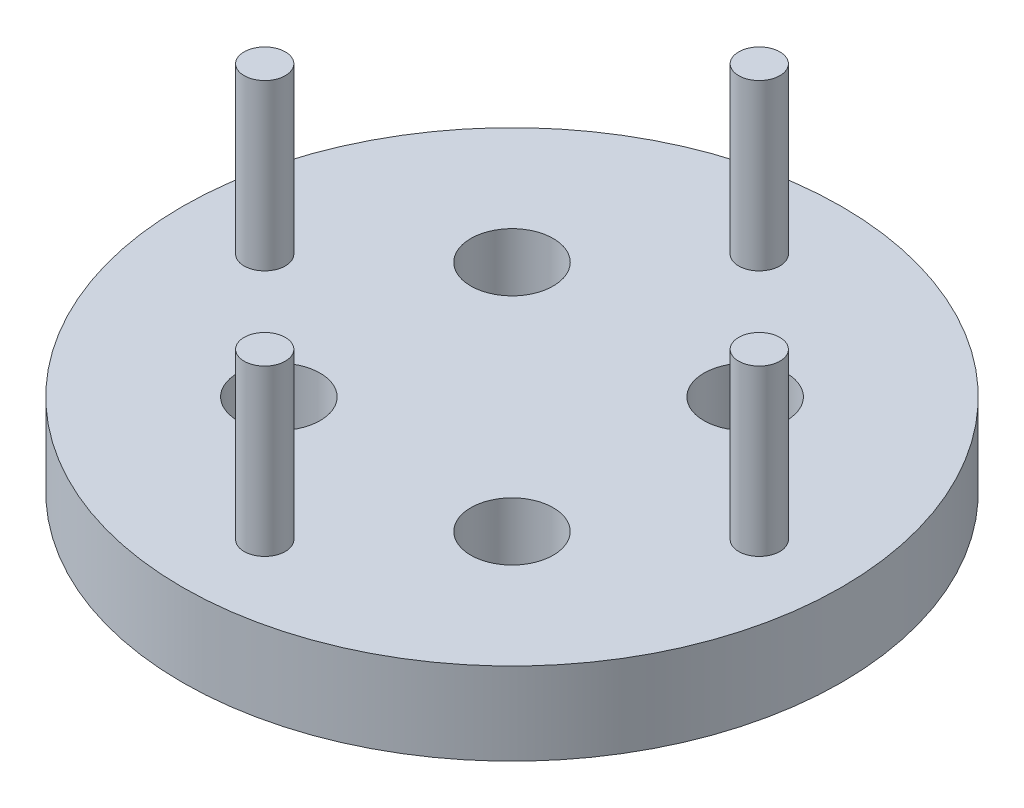
from build123d import *

# Parameters (mm, degrees)
SKETCH1_R           = 25.4
BOSS_EXTRUDE1_DEPTH = 6.35
SKETCH2_R           = 1.5875
BOSS_EXTRUDE2_DEPTH = 12.7
CIRPATTERN1_COUNT   = 4
SKETCH3_R           = 3.175
CUT_EXTRUDE1_DEPTH  = 41.659838908
CIRPATTERN2_COUNT   = 4


with BuildPart() as part:
    # Sketch1 → Boss-Extrude1 (new body)
    with BuildSketch(Plane(origin=(0, 0, 0), x_dir=(1, 0, 0), z_dir=(0, 1, 0))):
        with Locations(Location((0, 0, 0), (0, 0, 270))):
            Circle(SKETCH1_R)
    extrude(amount=BOSS_EXTRUDE1_DEPTH)

    # Sketch2 → Boss-Extrude2 (add)
    with BuildSketch(Plane(origin=(0, 6.35, 0), x_dir=(1, 0, 0), z_dir=(0, 1, 0))):
        with Locations(Location((-19.05, 0, 0), (0, 0, 270))):
            Circle(SKETCH2_R)
    boss_extrude2 = extrude(amount=BOSS_EXTRUDE2_DEPTH)

    # CirPattern1: Boss-Extrude2 ×4 about axis
    cirpattern1_axis = Axis((0, 0, 0), (0, 1, 0))
    for i in range(1, CIRPATTERN1_COUNT):
        add(boss_extrude2.rotate(cirpattern1_axis, i * 360 / CIRPATTERN1_COUNT))

    # Sketch3 → Cut-Extrude1 (cut, through all)
    with BuildSketch(Plane.XZ):
        with Locations(Location((8.980256121, -8.980256121, 0), (0, 0, 270))):
            Circle(SKETCH3_R)
    cut_extrude1 = extrude(amount=-CUT_EXTRUDE1_DEPTH, mode=Mode.SUBTRACT)

    # CirPattern2: Cut-Extrude1 ×4 about axis
    cirpattern2_axis = Axis((0, 0, 0), (0, 1, 0))
    for i in range(1, CIRPATTERN2_COUNT):
        add(cut_extrude1.rotate(cirpattern2_axis, i * 360 / CIRPATTERN2_COUNT), mode=Mode.SUBTRACT)


solid = part.part
